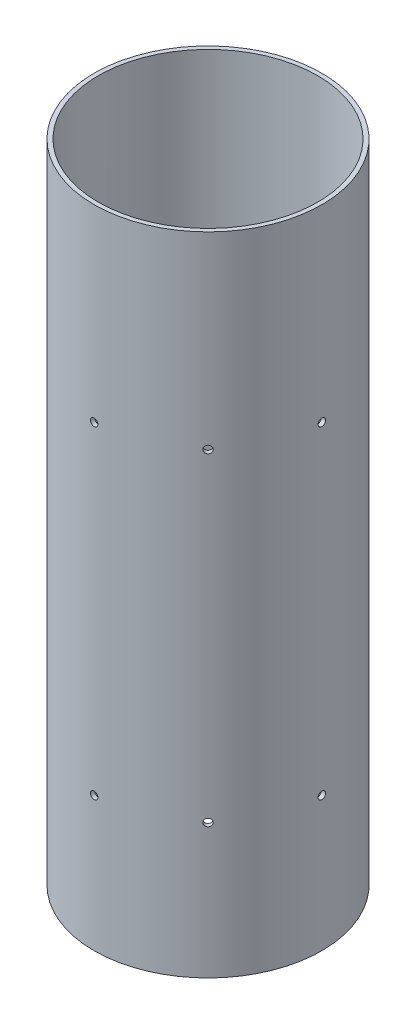
from build123d import *

# Parameters (mm, degrees)
SKETCH1_R           = 53.721
SKETCH1_R_2         = 51.7271
BOSS_EXTRUDE1_DEPTH = 304.8
SKETCH2_R           = 1.7526
CUT_EXTRUDE2_DEPTH  = 127
CIRPATTERN1_COUNT   = 8
SKETCH3_R           = 1.7526
CUT_EXTRUDE3_DEPTH  = 127
CIRPATTERN2_COUNT   = 8


with BuildPart() as part:
    # Sketch1 → Boss-Extrude1 (new body)
    with BuildSketch(Plane(origin=(0, 0, 0), x_dir=(1, 0, 0), z_dir=(0, 1, 0))):
        with Locations(Location((0, 0, 0), (0, 0, 90))):
            Circle(SKETCH1_R)
        with Locations(Location((0, 0, 0), (0, 0, 90))):
            Circle(SKETCH1_R_2, mode=Mode.SUBTRACT)
    extrude(amount=BOSS_EXTRUDE1_DEPTH)

    # Sketch2 → Cut-Extrude2 (cut)
    with BuildSketch(Plane.XY):
        with Locations(Location((0, 63.5, 0), (0, 0, 90))):
            Circle(SKETCH2_R)
    cut_extrude2 = extrude(amount=-CUT_EXTRUDE2_DEPTH, mode=Mode.SUBTRACT)

    # CirPattern1: Cut-Extrude2 ×8 about axis
    cirpattern1_axis = Axis((0, 304.8, 0), (0, -1, 0))
    for i in range(1, CIRPATTERN1_COUNT):
        add(cut_extrude2.rotate(cirpattern1_axis, i * 360 / CIRPATTERN1_COUNT), mode=Mode.SUBTRACT)

    # Sketch3 → Cut-Extrude3 (cut)
    with BuildSketch(Plane.XY):
        with Locations(Location((0, 215.9, 0), (0, 0, 90))):
            Circle(SKETCH3_R)
    cut_extrude3 = extrude(amount=-CUT_EXTRUDE3_DEPTH, mode=Mode.SUBTRACT)

    # CirPattern2: Cut-Extrude3 ×8 about axis
    cirpattern2_axis = Axis((0, 304.8, 0), (0, -1, 0))
    for i in range(1, CIRPATTERN2_COUNT):
        add(cut_extrude3.rotate(cirpattern2_axis, i * 360 / CIRPATTERN2_COUNT), mode=Mode.SUBTRACT)


solid = part.part
